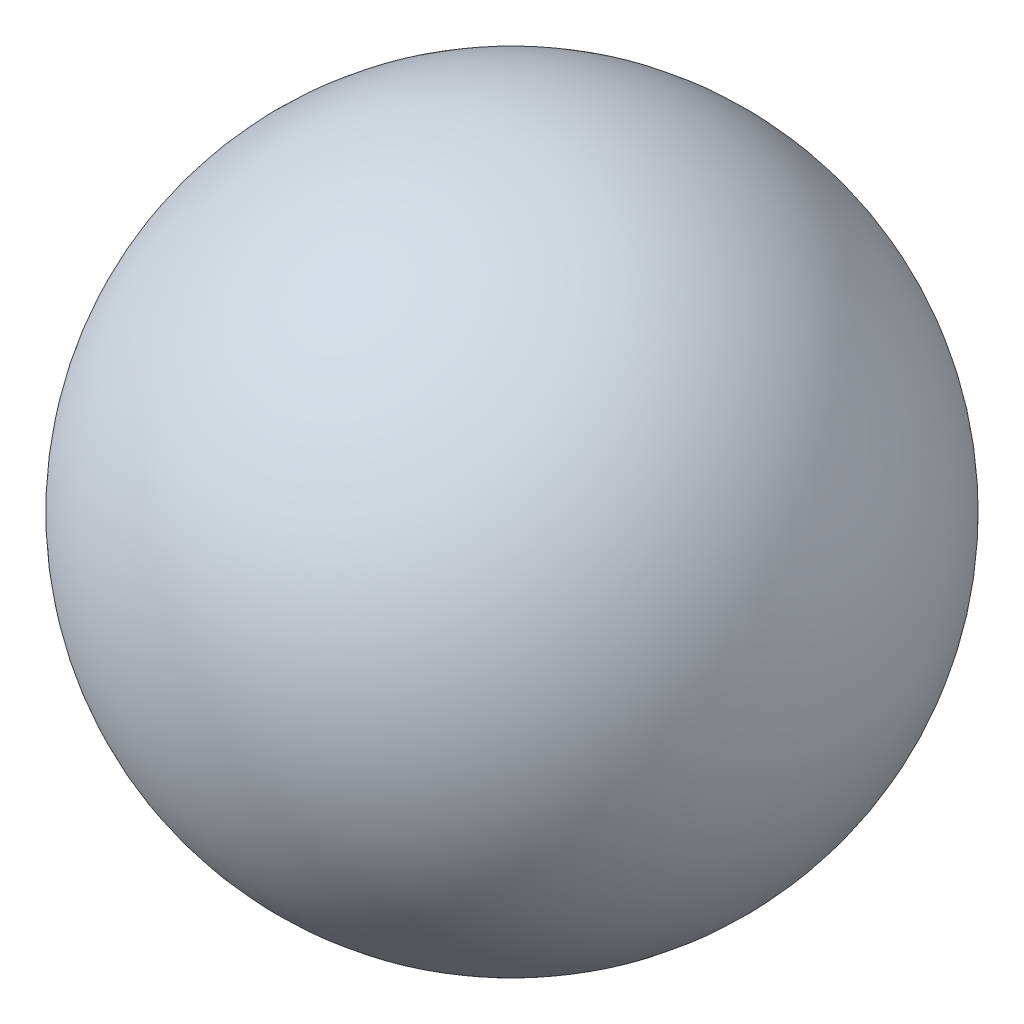
from build123d import *


with BuildPart() as part:
    # Sketch1 → Revolve1 (revolve)
    with BuildSketch(Plane(origin=(0, 0, 0), x_dir=(0, 1, 0), z_dir=(0, 0, 1))):
        with BuildLine():
            Line((-76.2, 0), (76.2, 0))
            ThreePointArc((76.2, 0), (0, 76.2), (-76.2, 0))
        make_face()
    revolve(axis=Axis((0, -76.2, 0), (0, 1, 0)))


solid = part.part
